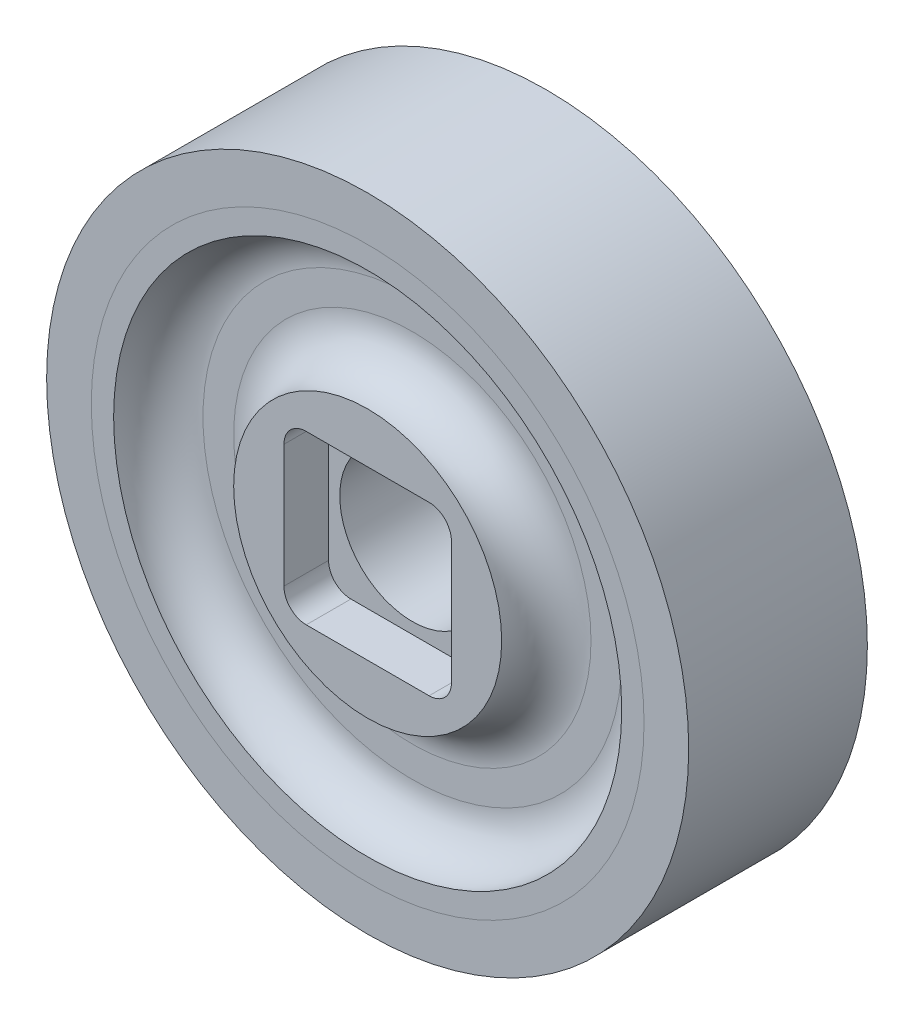
from build123d import *

# Parameters (mm, degrees)
SKETCH3_W          = 19.05
SKETCH3_H          = 19.05
CUT_EXTRUDE1_DEPTH = 5.08
SKETCH4_R          = 8.255
CUT_EXTRUDE2_DEPTH = 54.838489136
FILLET1_R          = 2.54


with BuildPart() as part:
    # Sketch1 → Revolve1 (revolve)
    with BuildSketch(Plane(origin=(0, 0, 0), x_dir=(0, 0, -1), z_dir=(1, 0, 0)), mode=Mode.PRIVATE) as revolve1_sk:
        with BuildLine():
            Line((-10.16, 31.4325), (-10.16, 28.8925))
            ThreePointArc((-10.16, 28.8925), (-6.567897552, 27.404602448), (-5.08, 23.8125))
            Line((-5.08, 23.8125), (-5.08, 20.32))
            ThreePointArc((-5.08, 20.32), (-6.567897552, 16.727897552), (-10.16, 15.24))
            Line((-10.16, 15.24), (-10.16, 0))
            Line((-10.16, 0), (10.16, 0))
            Line((10.16, 0), (10.16, 15.24))
            ThreePointArc((10.16, 15.24), (6.567897552, 16.727897552), (5.08, 20.32))
            Line((5.08, 20.32), (5.08, 23.8125))
            ThreePointArc((5.08, 23.8125), (6.567897552, 27.404602448), (10.16, 28.8925))
            Line((10.16, 28.8925), (10.16, 31.4325))
            Line((10.16, 31.4325), (5.08, 31.4325))
            Line((5.08, 31.4325), (5.08, 34.1249))
            Line((5.08, 34.1249), (-5.08, 34.1249))
            Line((-5.08, 34.1249), (-5.08, 31.4325))
            Line((-5.08, 31.4325), (-10.16, 31.4325))
        make_face()
    revolve(revolve1_sk.sketch.rotate(Axis((0, 0, 33.990714689), (0, 0, -1)), 90), axis=Axis((0, 0, 33.990714689), (0, 0, -1)))

    # Sketch3 → Cut-Extrude1 (cut)
    with BuildSketch(Plane.XY.offset(10.16)):
        Rectangle(SKETCH3_W, SKETCH3_H)
    extrude(amount=-CUT_EXTRUDE1_DEPTH, mode=Mode.SUBTRACT)

    # Sketch4 → Cut-Extrude2 (cut, through all)
    with BuildSketch(Plane.XY.offset(5.08)):
        Circle(SKETCH4_R)
    extrude(amount=-CUT_EXTRUDE2_DEPTH, mode=Mode.SUBTRACT)

    # Fillet1
    fillet1_edges = [part.edges().sort_by_distance(p)[0] for p in [
        (9.525, 9.525, 7.62),
        (9.525, -9.525, 7.62),
        (-9.525, -9.525, 7.62),
        (-9.525, 9.525, 7.62),
    ]]
    fillet(fillet1_edges, radius=FILLET1_R)


with BuildPart() as body_2:
    # Sketch2 → Revolve2 (revolve)
    with BuildSketch(Plane(origin=(0, 0, 0), x_dir=(0, 0, -1), z_dir=(1, 0, 0)), mode=Mode.PRIVATE) as revolve2_sk:
        Polygon((-10.16, 31.4325), (-5.08, 31.4325), (-5.08, 34.1249), (5.08, 34.1249), (5.08, 31.4325), (10.16, 31.4325), (10.16, 36.5125), (-10.16, 36.5125), align=None)
    revolve(revolve2_sk.sketch.rotate(Axis((0, 0, 72.484250803), (0, 0, -1)), 90), axis=Axis((0, 0, 72.484250803), (0, 0, -1)))


solid = Compound([part.part, body_2.part])
